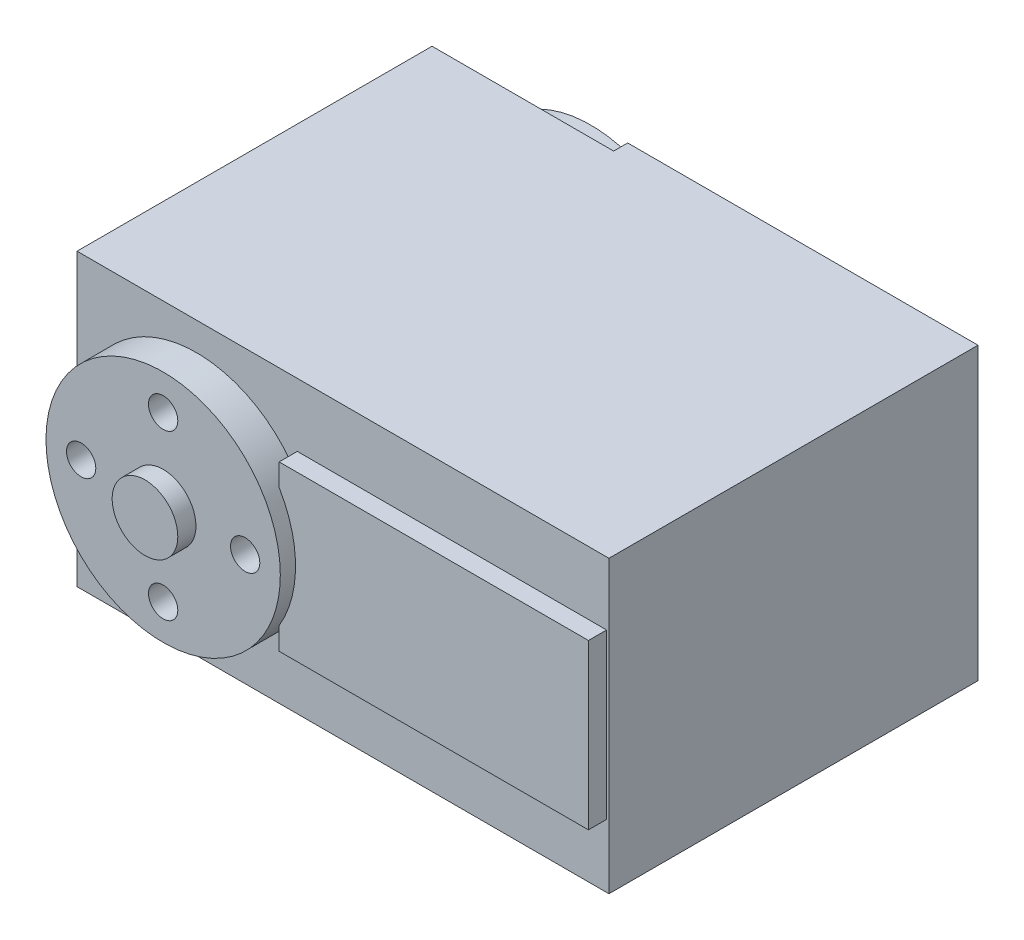
from build123d import *

# Parameters (mm, degrees)
S_BOX1_W      = 45.4
S_BOX1_H      = 24.8
BOSS_1_DEPTH  = 30.3
S_BOX2_W      = 29.9
S_BOX2_H      = 24.8
BOSS_2_DEPTH  = 1.3
S_BOX3_W      = 13.2
S_BOX3_H      = 18.4
BOSS_3_DEPTH  = 2.35
S_CYL4_R      = 3
BOSS_4_DEPTH  = 4.05
S_BOX5_W      = 26.4
S_BOX5_H      = 14
BOSS_5_DEPTH  = 1.65
S_CYL6_R      = 5.3
BOSS_6_DEPTH  = 0.6
S_CYL7_R      = 10
BOSS_7_DEPTH  = 2.2
S_CYL8_R      = 10
BOSS_8_DEPTH  = 2.95
S_CYL9_R      = 2.8
BOSS_9_DEPTH  = 1.65
S_HOLE10_R    = 1.25
HOLE_10_DEPTH = 2.25
S_HOLE11_R    = 1.25
HOLE_11_DEPTH = 2.25
S_HOLE12_R    = 1.25
HOLE_12_DEPTH = 2.25
S_HOLE13_R    = 1.25
HOLE_13_DEPTH = 2.25
S_HOLE14_R    = 1.25
HOLE_14_DEPTH = 2.6
S_HOLE15_R    = 1.25
HOLE_15_DEPTH = 2.6
S_HOLE16_R    = 1.25
HOLE_16_DEPTH = 2.6
S_HOLE17_R    = 1.25
HOLE_17_DEPTH = 2.6
S_HOLE18_R    = 0.8
HOLE_18_DEPTH = 3
S_HOLE19_R    = 0.8
HOLE_19_DEPTH = 3
S_HOLE20_R    = 0.8
HOLE_20_DEPTH = 3
S_HOLE21_R    = 0.8
HOLE_21_DEPTH = 3


with BuildPart() as part:
    # S_box1 → Boss_1 (new body)
    with BuildSketch(Plane.XY.offset(-14.4)):
        with Locations((12.5, 0)):
            Rectangle(S_BOX1_W, S_BOX1_H)
    extrude(amount=BOSS_1_DEPTH)

    # S_box2 → Boss_2 (add)
    with BuildSketch(Plane.XY.offset(-15.6)):
        with Locations((20.25, 0)):
            Rectangle(S_BOX2_W, S_BOX2_H)
    extrude(amount=BOSS_2_DEPTH)

    # S_box3 → Boss_3 (add)
    with BuildSketch(Plane.XY.offset(-17.85)):
        with Locations((23.3, 0)):
            Rectangle(S_BOX3_W, S_BOX3_H)
    extrude(amount=BOSS_3_DEPTH)

    # S_cyl4 → Boss_4 (add)
    with BuildSketch(Plane.XY.offset(-18.35)):
        Circle(S_CYL4_R)
    extrude(amount=BOSS_4_DEPTH)

    # S_box5 → Boss_5 (add)
    with BuildSketch(Plane.XY.offset(15.8)):
        with Locations((21.8, 0)):
            Rectangle(S_BOX5_W, S_BOX5_H)
    extrude(amount=BOSS_5_DEPTH)

    # S_cyl6 → Boss_6 (add)
    with BuildSketch(Plane.XY.offset(15.8)):
        with Locations(Location((0, 0, 0), (0, 0, 180))):
            Circle(S_CYL6_R)
    extrude(amount=BOSS_6_DEPTH)

    # S_cyl7 → Boss_7 (add)
    with BuildSketch(Plane.XY.offset(-17.75)):
        with Locations(Location((0, 0, 0), (0, 0, 302.005454828))):
            Circle(S_CYL7_R)
    extrude(amount=BOSS_7_DEPTH)

    # S_cyl8 → Boss_8 (add)
    with BuildSketch(Plane.XY.offset(15.8)):
        with Locations(Location((0, 0, 0), (0, 0, 302.005454828))):
            Circle(S_CYL8_R)
    extrude(amount=BOSS_8_DEPTH)

    # S_cyl9 → Boss_9 (add)
    with BuildSketch(Plane.XY.offset(18.65)):
        Circle(S_CYL9_R)
    extrude(amount=BOSS_9_DEPTH)

    # S_hole10 → Hole_10 (cut)
    with BuildSketch(Plane.XY.offset(-17.85)):
        with Locations((7, 0)):
            Circle(S_HOLE10_R)
    extrude(amount=HOLE_10_DEPTH, mode=Mode.SUBTRACT)

    # S_hole11 → Hole_11 (cut)
    with BuildSketch(Plane.XY.offset(-17.85)):
        with Locations((0, 7)):
            Circle(S_HOLE11_R)
    extrude(amount=HOLE_11_DEPTH, mode=Mode.SUBTRACT)

    # S_hole12 → Hole_12 (cut)
    with BuildSketch(Plane.XY.offset(-17.85)):
        with Locations((-7, 0)):
            Circle(S_HOLE12_R)
    extrude(amount=HOLE_12_DEPTH, mode=Mode.SUBTRACT)

    # S_hole13 → Hole_13 (cut)
    with BuildSketch(Plane.XY.offset(-17.85)):
        with Locations((0, -7)):
            Circle(S_HOLE13_R)
    extrude(amount=HOLE_13_DEPTH, mode=Mode.SUBTRACT)

    # S_hole14 → Hole_14 (cut)
    with BuildSketch(Plane.XY.offset(16.25)):
        with Locations((7, 0)):
            Circle(S_HOLE14_R)
    extrude(amount=HOLE_14_DEPTH, mode=Mode.SUBTRACT)

    # S_hole15 → Hole_15 (cut)
    with BuildSketch(Plane.XY.offset(16.25)):
        with Locations((0, 7)):
            Circle(S_HOLE15_R)
    extrude(amount=HOLE_15_DEPTH, mode=Mode.SUBTRACT)

    # S_hole16 → Hole_16 (cut)
    with BuildSketch(Plane.XY.offset(16.25)):
        with Locations((-7, 0)):
            Circle(S_HOLE16_R)
    extrude(amount=HOLE_16_DEPTH, mode=Mode.SUBTRACT)

    # S_hole17 → Hole_17 (cut)
    with BuildSketch(Plane.XY.offset(16.25)):
        with Locations((0, -7)):
            Circle(S_HOLE17_R)
    extrude(amount=HOLE_17_DEPTH, mode=Mode.SUBTRACT)

    # S_hole18 → Hole_18 (cut)
    with BuildSketch(Plane.XY.offset(-15.7)):
        with Locations((8.3, -10.25)):
            Circle(S_HOLE18_R)
    extrude(amount=HOLE_18_DEPTH, mode=Mode.SUBTRACT)

    # S_hole19 → Hole_19 (cut)
    with BuildSketch(Plane.XY.offset(-15.7)):
        with Locations((8.3, 10.25)):
            Circle(S_HOLE19_R)
    extrude(amount=HOLE_19_DEPTH, mode=Mode.SUBTRACT)

    # S_hole20 → Hole_20 (cut)
    with BuildSketch(Plane.XY.offset(-15.7)):
        with Locations((32.75, -10.25)):
            Circle(S_HOLE20_R)
    extrude(amount=HOLE_20_DEPTH, mode=Mode.SUBTRACT)

    # S_hole21 → Hole_21 (cut)
    with BuildSketch(Plane.XY.offset(-15.7)):
        with Locations((32.75, 10.25)):
            Circle(S_HOLE21_R)
    extrude(amount=HOLE_21_DEPTH, mode=Mode.SUBTRACT)


solid = part.part
